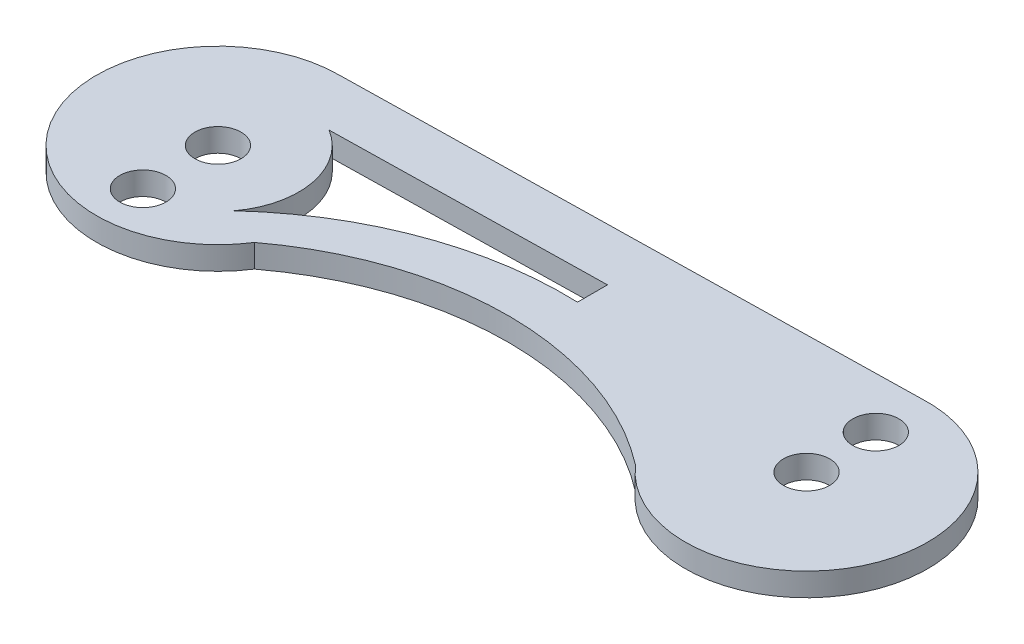
from build123d import *

# Parameters (mm, degrees)
SKETCH1_R           = 2
BOSS_EXTRUDE5_DEPTH = 2


with BuildPart() as part:
    # Sketch1 → Boss-Extrude5 (new body)
    with BuildSketch(Plane(origin=(0, 0, 0), x_dir=(1, 0, 0), z_dir=(0, 1, 0))):
        with BuildLine():
            Line((-33.661525998, 9.558347037), (15.746838945, 10.493683155))
            ThreePointArc((15.746838945, 10.493683155), (25.998283023, -4.08303674), (8.397040734, -6.870354169))
            ThreePointArc((8.397040734, -6.870354169), (-8.169868029, -1.163623151), (-24.804581512, -6.669579217))
            ThreePointArc((-24.804581512, -6.669579217), (-42.905321973, -6.017722997), (-33.661525998, 9.558347037))
        make_face()
        with Locations(Location((-33.661525998, -0.972605925, 0), (0, 0, 270))):
            Circle(SKETCH1_R, mode=Mode.SUBTRACT)
        with Locations(Location((-33.661525998, -7.472605925, 0), (0, 0, 270))):
            Circle(SKETCH1_R, mode=Mode.SUBTRACT)
        with Locations(Location((16.328821379, 0.009824302, 0), (0, 0, 270))):
            Circle(SKETCH1_R, mode=Mode.SUBTRACT)
        with Locations(Location((16.328821379, 6.009824302, 0), (0, 0, 270))):
            Circle(SKETCH1_R, mode=Mode.SUBTRACT)
        with BuildLine():
            Line((-29.996106609, 4.99100881), (-6.337353933, 5.438886126))
            Line((-6.337353933, 5.438886126), (-6.337353933, 2.841108528))
            ThreePointArc((-6.337353933, 2.841108528), (-17.995175719, 0.977836677), (-28.067473468, -5.180524211))
            ThreePointArc((-28.067473468, -5.180524211), (-26.784064544, 0.331435467), (-29.996106609, 4.99100881))
        make_face(mode=Mode.SUBTRACT)
    extrude(amount=BOSS_EXTRUDE5_DEPTH)


solid = part.part
